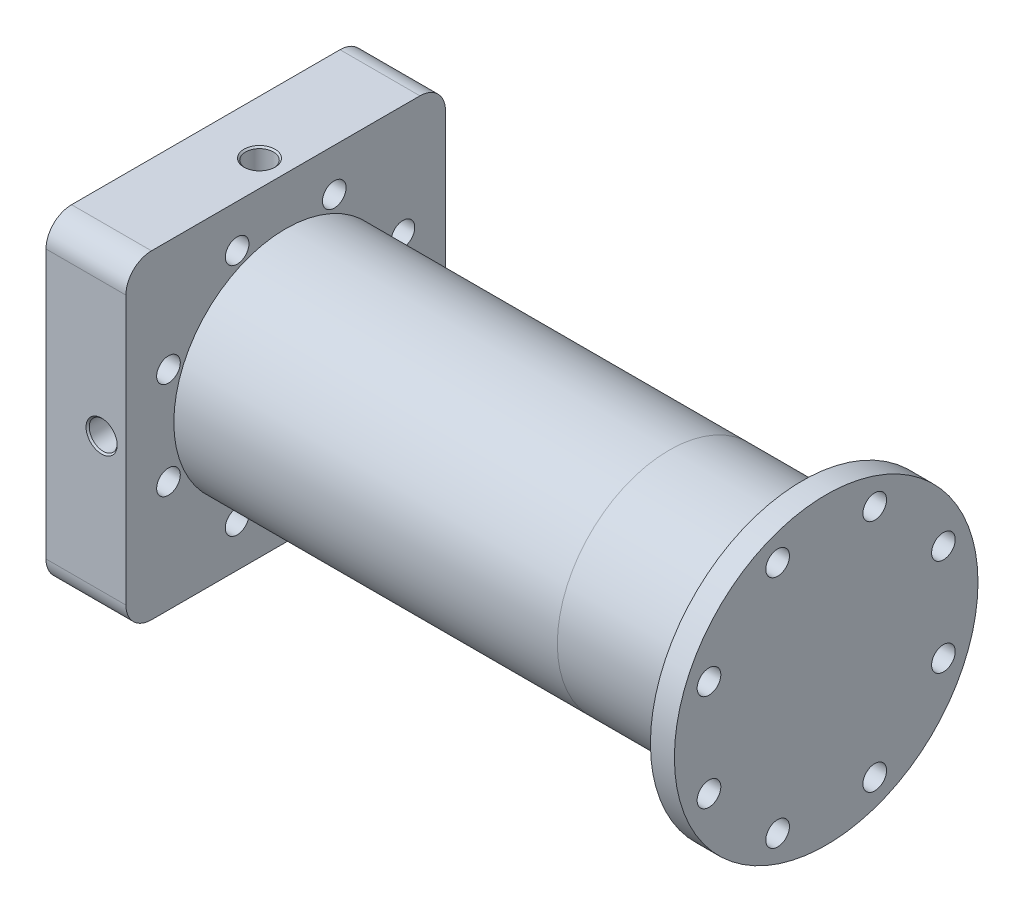
from build123d import *

# Parameters (mm, degrees)
FILLET1_R               = 1.27
CUT_EXTRUDE1_REACH      = 246.555
SKETCH2_R               = 3.81
CIRPATTERN1_COUNT       = 8
SKETCH4_R               = 63.5
BOSS_EXTRUDE1_DEPTH     = 31.75
SKETCH11_W              = 127
SKETCH11_H              = 127
BOSS_EXTRUDE2_DEPTH     = 31.75
SKETCH12_R              = 24.13
CUT_EXTRUDE4_DEPTH      = 16.51
CUT_EXTRUDE5_START      = -39.450428
SKETCH13_R              = 1.9685
CUT_EXTRUDE5_DEPTH      = 39.450428
CHAMFER1_SIZE           = 4.572
FILLET2_R               = 0.889
FILLET3_R               = 0.508
CUT_EXTRUDE9_REACH      = 270.149
CUT_EXTRUDE9_END_RADIUS = 24.13
SKETCH31_R              = 1.5875
SKETCH33_R              = 44.45
SKETCH33_R_2            = 34.925
BOSS_EXTRUDE4_DEPTH     = 152.4
FILLET5_R               = 1.27
FILLET6_R               = 10.16
SKETCH39_R              = 60.325
SKETCH39_R_2            = 36.195
BOSS_EXTRUDE6_DEPTH     = 9.525
SKETCH40_R              = 4.699
CUT_EXTRUDE13_DEPTH     = 251.487228873
CIRPATTERN3_COUNT       = 8
SKETCH44_R              = 1.7653
SKETCH46_R              = 38.1
BOSS_EXTRUDE7_DEPTH     = 3.175
SKETCH47_R              = 60.325
SKETCH47_R_2            = 4.699
BOSS_EXTRUDE8_DEPTH     = 9.525


with BuildPart() as part:
    # Chamber Revolve → Revolve1 (revolve)
    with BuildSketch(Plane.XY, mode=Mode.PRIVATE) as revolve1_sk:
        with BuildLine():
            Line((227.4696953, 63.5), (227.4696953, 26.67))
            Line((227.4696953, 26.67), (191.916500941, 17.143550283))
            ThreePointArc((191.916500941, 17.143550283), (190.601700192, 17.143550283), (189.463049342, 17.800950658))
            Line((189.463049342, 17.800950658), (173.736, 33.528))
            Line((173.736, 33.528), (0, 33.528))
            Line((0, 33.528), (0, 42.164))
            Line((0, 42.164), (3.8608, 42.164))
            Line((3.8608, 42.164), (3.8608, 48.2346))
            Line((3.8608, 48.2346), (0, 48.2346))
            Line((0, 48.2346), (0, 63.5))
            Line((0, 63.5), (10.16, 63.5))
            Line((10.16, 63.5), (10.16, 47.244))
            Line((10.16, 47.244), (24.13, 47.244))
            Line((24.13, 47.244), (24.13, 63.5))
            Line((24.13, 63.5), (227.4696953, 63.5))
        make_face()
    revolve(revolve1_sk.sketch.rotate(Axis((0, 0, 0), (1, 0, 0)), 90), axis=Axis((0, 0, 0), (1, 0, 0)))

    # Fillet1
    fillet1_edges = [part.edges().sort_by_distance(p)[0] for p in [
        (24.13, 0, -47.244),
        (10.16, 0, -47.244),
    ]]
    fillet(fillet1_edges, radius=FILLET1_R)

    # Sketch2 → Cut-Extrude1 (cut, up to next)
    with BuildSketch(Plane.ZY, mode=Mode.PRIVATE) as cut_extrude1_sk1:
        with Locations((-21.773156568, 52.565049882)):
            Circle(SKETCH2_R)
    cut_extrude1_tool1 = extrude(cut_extrude1_sk1.sketch, amount=-CUT_EXTRUDE1_REACH, mode=Mode.PRIVATE) & part.part
    cut_extrude1 = cut_extrude1_tool1.solids().sort_by_distance((0, 52.56505, -21.773157))[0]
    add(cut_extrude1, mode=Mode.SUBTRACT)

    # CirPattern1: Cut-Extrude1 ×8 about axis
    cirpattern1_axis = Axis((0, 0, 0), (1, 0, 0))
    for i in range(1, CIRPATTERN1_COUNT):
        add(cut_extrude1.rotate(cirpattern1_axis, i * 360 / CIRPATTERN1_COUNT), mode=Mode.SUBTRACT)

    # Fillet2
    fillet2_edges = [part.edges().sort_by_distance(p)[0] for p in [
        (3.8608, 0, -42.164),
        (3.8608, 0, -48.2346),
    ]]
    fillet(fillet2_edges, radius=FILLET2_R)


with BuildPart() as body_2:
    # Sketch4 → Boss-Extrude1 (new body)
    with BuildSketch(Plane.ZY):
        Circle(SKETCH4_R)
    extrude(amount=BOSS_EXTRUDE1_DEPTH)

    # Sketch11 → Boss-Extrude2 (add)
    with BuildSketch(Plane.ZY.offset(31.75)):
        Rectangle(SKETCH11_W, SKETCH11_H)
    extrude(amount=-BOSS_EXTRUDE2_DEPTH)

    # Sketch12 → Cut-Extrude4 (cut)
    with BuildSketch(Plane(origin=(0, 0, 0), x_dir=(0, 0, -1), z_dir=(1, 0, 0))):
        Circle(SKETCH12_R)
    extrude(amount=-CUT_EXTRUDE4_DEPTH, mode=Mode.SUBTRACT)

    # Sketch13 → Cut-Extrude5 (cut)
    with BuildSketch(Plane.XY.offset(63.5).offset(CUT_EXTRUDE5_START)):
        with Locations((-9.652, 0)):
            Circle(SKETCH13_R)
    cut_extrude5 = extrude(amount=CUT_EXTRUDE5_DEPTH, mode=Mode.SUBTRACT)

    # Chamfer1
    chamfer1_edges = [body_2.edges().sort_by_distance(p)[0] for p in [
        (0, 0, 24.13),
    ]]
    chamfer(chamfer1_edges, length=CHAMFER1_SIZE)

    # Sketch20 → 7/16 (0.4375) Diameter Hole1 (revolve, cut)
    with BuildSketch(Plane(origin=(-9.652, 0, 63.5), x_dir=(0, -1, 0), z_dir=(1, 0, 0))):
        Polygon((0, 0), (0, 22.388531814), (5.55625, 19.05), (5.55625, 0.635), (6.19125, 0), align=None)
    f_7_16_0_4375_diameter_hole1 = revolve(axis=Axis((-9.652, 0, 69.85), (0, 0, -1)), mode=Mode.SUBTRACT)

    # Mirror1: Cut-Extrude5, 7/16 (0.4375) Diameter Hole1 across plane
    add(cut_extrude5.mirror(Plane.XY), mode=Mode.SUBTRACT)
    add(f_7_16_0_4375_diameter_hole1.mirror(Plane.XY), mode=Mode.SUBTRACT)

    # Sketch23 → Ø6.7 (6.7) Diameter Hole1 (revolve, cut)
    with BuildSketch(Plane(origin=(-31.75, -33.02, 0), x_dir=(0, 0, 1), z_dir=(0, 1, 0))):
        Polygon((0, 0), (0, 15.220883074), (3.35, 13.208), (3.35, 0.4), (3.75, 0), align=None)
    f_6_7_6_7_diameter_hole1 = revolve(axis=Axis((-38.1, -33.02, 0), (1, 0, 0)), mode=Mode.SUBTRACT)

    # Mirror2: Ø6.7 (6.7) Diameter Hole1 across plane
    add(f_6_7_6_7_diameter_hole1.mirror(Plane.ZX), mode=Mode.SUBTRACT)

    # Sketch24 → Cut-Revolve1 (revolve, cut)
    with BuildSketch(Plane(origin=(0, 0, 0), x_dir=(1, 0, 0), z_dir=(0, 1, 0))):
        with BuildLine():
            Line((-31.75, 7.1374), (-30.958106371, 5.7658))
            Line((-30.958106371, 5.7658), (-29.845, 5.7658))
            ThreePointArc((-29.845, 5.7658), (-29.650596816, 5.727130803), (-29.485789755, 5.617010245))
            Line((-29.485789755, 5.617010245), (-28.73287951, 4.8641))
            Line((-28.73287951, 4.8641), (-16.51, 4.8641))
            Line((-16.51, 4.8641), (-16.51, 0))
            Line((-16.51, 0), (-31.75, 0))
            Line((-31.75, 0), (-31.75, 7.1374))
        make_face()
    revolve(axis=Axis((227.4696953, 0, 0), (-1, 0, 0)), mode=Mode.SUBTRACT)

    # Fillet3
    fillet3_edges = [body_2.edges().sort_by_distance(p)[0] for p in [
        (-30.958106371, 0, 5.7658),
    ]]
    fillet(fillet3_edges, radius=FILLET3_R)

    # Sketch30 → 7/16 (0.4375) Diameter Hole2 (revolve, cut)
    with BuildSketch(Plane(origin=(-10.414, -63.5, 0), x_dir=(0, 0, -1), z_dir=(1, 0, 0))):
        Polygon((0, 0), (0, 22.388531814), (5.55625, 19.05), (5.55625, 0.635), (6.19125, 0), align=None)
    f_7_16_0_4375_diameter_hole2 = revolve(axis=Axis((-10.414, -69.85, 0), (0, 1, 0)), mode=Mode.SUBTRACT)

    # Cut-Extrude9: up to this cylinder (the profile starts outside it)
    cut_extrude9_end = Plane(origin=(-10.414, 0, 0), z_dir=(1, 0, 0)) * Cylinder(CUT_EXTRUDE9_END_RADIUS, 589.558, mode=Mode.PRIVATE)
    # Sketch31 → Cut-Extrude9 (cut, up to the surface)
    with BuildSketch(Plane.XZ.offset(63.5), mode=Mode.PRIVATE) as cut_extrude9_sk1:
        with Locations(Location((-10.414, 0, 0), (0, 0, 270))):
            Circle(SKETCH31_R)
    cut_extrude9_tool1 = extrude(cut_extrude9_sk1.sketch, amount=-CUT_EXTRUDE9_REACH, mode=Mode.PRIVATE) - cut_extrude9_end
    cut_extrude9 = cut_extrude9_tool1.solids().sort_by_distance((-10.414, -63.5, 0))[0]
    add(cut_extrude9, mode=Mode.SUBTRACT)

    # Mirror3: 7/16 (0.4375) Diameter Hole2, Cut-Extrude9 across plane
    add(f_7_16_0_4375_diameter_hole2.mirror(Plane.ZX), mode=Mode.SUBTRACT)
    add(cut_extrude9.mirror(Plane.ZX), mode=Mode.SUBTRACT)

    # Fillet6
    fillet6_edges = [body_2.edges().sort_by_distance(p)[0] for p in [
        (-15.875, -63.5, 63.5),
        (-15.875, 63.5, 63.5),
        (-15.875, -63.5, -63.5),
        (-15.875, 63.5, -63.5),
    ]]
    fillet(fillet6_edges, radius=FILLET6_R)


with BuildPart() as body_3:
    # Sketch21 → Revolve2 (revolve)
    with BuildSketch(Plane(origin=(0, 0, 0), x_dir=(1, 0, 0), z_dir=(0, 1, 0))):
        Polygon((0, 33.528), (173.736, 33.528), (189.463049342, 17.800950658), (189.463049342, 0), (0, 0), align=None)
    revolve(axis=Axis((189.463049342, 0, 0), (1, 0, 0)))


with BuildPart() as body_3_2:
    # Sketch33 → Boss-Extrude4 (new body)
    with BuildSketch(Plane(origin=(0, 0, 0), x_dir=(0, 0, -1), z_dir=(1, 0, 0))):
        with Locations(Location((0, 0, 0), (0, 0, 180))):
            Circle(SKETCH33_R)
        with Locations(Location((0, 0, 0), (0, 0, 180))):
            Circle(SKETCH33_R_2, mode=Mode.SUBTRACT)
    extrude(amount=BOSS_EXTRUDE4_DEPTH)


with BuildPart() as body_4:
    # Sketch34 → Revolve3 (revolve)
    with BuildSketch(Plane.XY, mode=Mode.PRIVATE) as revolve3_sk:
        Polygon((152.4, 44.45), (152.4, 34.925), (165.116469101, 16.764), (202.086164401, 26.67), (202.086164401, 44.45), align=None)
    revolve(revolve3_sk.sketch.rotate(Axis((152.4, 0, 0), (-1, 0, 0)), 90), axis=Axis((152.4, 0, 0), (-1, 0, 0)))

    # Fillet5
    fillet5_edges = [body_4.edges().sort_by_distance(p)[0] for p in [
        (165.116469101, 0, 16.764),
    ]]
    fillet(fillet5_edges, radius=FILLET5_R)

    # Sketch45 → Cut-Revolve3 (revolve, cut)
    with BuildSketch(Plane.XY, mode=Mode.PRIVATE) as cut_revolve3_sk:
        with BuildLine():
            Line((152.4, 41.4274), (154.5336, 41.4274))
            ThreePointArc((154.5336, 41.4274), (154.892810245, 41.278610245), (155.0416, 40.9194))
            Line((155.0416, 40.9194), (155.0416, 37.846))
            ThreePointArc((155.0416, 37.846), (154.892810245, 37.486789755), (154.5336, 37.338))
            Line((154.5336, 37.338), (152.4, 37.338))
            Line((152.4, 37.338), (152.4, 41.4274))
        make_face()
    revolve(cut_revolve3_sk.sketch.rotate(Axis((0, 0, 0), (1, 0, 0)), 90), axis=Axis((0, 0, 0), (1, 0, 0)), mode=Mode.SUBTRACT)


with BuildPart() as body_5:
    # Sketch39 → Boss-Extrude6 (new body)
    with BuildSketch(Plane(origin=(202.086164401, 0, 0), x_dir=(0, 0, -1), z_dir=(1, 0, 0))):
        with Locations(Location((0, 0, 0), (0, 0, 180))):
            Circle(SKETCH39_R)
        with Locations(Location((0, 0, 0), (0, 0, 180))):
            Circle(SKETCH39_R_2, mode=Mode.SUBTRACT)
    extrude(amount=BOSS_EXTRUDE6_DEPTH)


with BuildPart() as cut_extrude13_tool:
    # Sketch40 → Cut-Extrude13 (new, symmetric)
    with BuildSketch(Plane.ZY.offset(-202.086164401)):
        with Locations(Location((-19.294515976, 46.58108215, 0), (0, 0, 180))):
            Circle(SKETCH40_R)
    cut_extrude13 = extrude(amount=CUT_EXTRUDE13_DEPTH, both=True)


with BuildPart() as body_2_1:
    add(body_2.part)

    # Cut-Extrude13: cut by cut_extrude13_tool
    add(cut_extrude13_tool.part, mode=Mode.SUBTRACT)


with BuildPart() as body_5_1:
    add(body_5.part)

    # Cut-Extrude13: cut by cut_extrude13_tool
    add(cut_extrude13_tool.part, mode=Mode.SUBTRACT)


with BuildPart() as cirpattern3_tool:
    # CirPattern3: Cut-Extrude13 ×8 about axis
    cirpattern3_axis = Axis((0, 0, 0), (1, 0, 0))
    for i in range(1, CIRPATTERN3_COUNT):
        add(cut_extrude13.rotate(cirpattern3_axis, i * 360 / CIRPATTERN3_COUNT))


with BuildPart() as body_2_2:
    add(body_2_1.part)

    # CirPattern3: cut by cirpattern3_tool
    add(cirpattern3_tool.part, mode=Mode.SUBTRACT)

    # Sketch41 → Cut-Revolve2 (revolve, cut)
    with BuildSketch(Plane.XY, mode=Mode.PRIVATE) as cut_revolve2_sk:
        with BuildLine():
            Line((0, 37.338), (-2.1844, 37.338))
            ThreePointArc((-2.1844, 37.338), (-2.50768922, 37.47191078), (-2.6416, 37.7952))
            Line((-2.6416, 37.7952), (-2.6416, 40.9702))
            ThreePointArc((-2.6416, 40.9702), (-2.50768922, 41.29348922), (-2.1844, 41.4274))
            Line((-2.1844, 41.4274), (0, 41.4274))
            Line((0, 41.4274), (0, 37.338))
        make_face()
    revolve(cut_revolve2_sk.sketch.rotate(Axis((0, 0, 0), (1, 0, 0)), 90), axis=Axis((0, 0, 0), (1, 0, 0)), mode=Mode.SUBTRACT)


with BuildPart() as body_5_2:
    add(body_5_1.part)

    # CirPattern3: cut by cirpattern3_tool
    add(cirpattern3_tool.part, mode=Mode.SUBTRACT)


with BuildPart() as body_6:
    # Sketch44 → Revolve4 (revolve)
    with BuildSketch(Plane.XY, mode=Mode.PRIVATE) as revolve4_sk:
        with Locations((-0.8763, 39.6621)):
            Circle(SKETCH44_R)
    revolve(revolve4_sk.sketch.rotate(Axis((0, 0, 0), (1, 0, 0)), 90), axis=Axis((0, 0, 0), (1, 0, 0)))


with BuildPart() as body_7:
    # Mirror9: mirrored copy
    add(body_6.part.mirror(Plane(origin=(76.2, 0, 0), x_dir=(0, 0, 1), z_dir=(1, 0, 0))))


with BuildPart() as body_7_2:
    # Sketch46 → Boss-Extrude7 (new body)
    with BuildSketch(Plane(origin=(202.086164401, 0, 0), x_dir=(0, 0, -1), z_dir=(1, 0, 0))):
        Circle(SKETCH46_R)
    extrude(amount=BOSS_EXTRUDE7_DEPTH)


with BuildPart() as body_8:
    # Sketch47 → Boss-Extrude8 (new body)
    with BuildSketch(Plane(origin=(205.261164401, 0, 0), x_dir=(0, 0, -1), z_dir=(1, 0, 0))):
        with Locations(Location((0, 0, 0), (0, 0, 180))):
            Circle(SKETCH47_R)
        with Locations(Location((-46.58108215, 19.294515976, 0), (0, 0, 180))):
            Circle(SKETCH47_R_2, mode=Mode.SUBTRACT)
        with Locations(Location((-46.58108215, -19.294515976, 0), (0, 0, 180))):
            Circle(SKETCH47_R_2, mode=Mode.SUBTRACT)
        with Locations(Location((-19.294515976, -46.58108215, 0), (0, 0, 180))):
            Circle(SKETCH47_R_2, mode=Mode.SUBTRACT)
        with Locations(Location((19.294515976, -46.58108215, 0), (0, 0, 180))):
            Circle(SKETCH47_R_2, mode=Mode.SUBTRACT)
        with Locations(Location((46.58108215, -19.294515976, 0), (0, 0, 180))):
            Circle(SKETCH47_R_2, mode=Mode.SUBTRACT)
        with Locations(Location((46.58108215, 19.294515976, 0), (0, 0, 180))):
            Circle(SKETCH47_R_2, mode=Mode.SUBTRACT)
        with Locations(Location((19.294515976, 46.58108215, 0), (0, 0, 180))):
            Circle(SKETCH47_R_2, mode=Mode.SUBTRACT)
        with Locations(Location((-19.294515976, 46.58108215, 0), (0, 0, 180))):
            Circle(SKETCH47_R_2, mode=Mode.SUBTRACT)
    extrude(amount=BOSS_EXTRUDE8_DEPTH)


solid = Compound([body_3.part, body_3_2.part, body_4.part, body_2_2.part, body_6.part, body_7.part, body_7_2.part, body_8.part])
